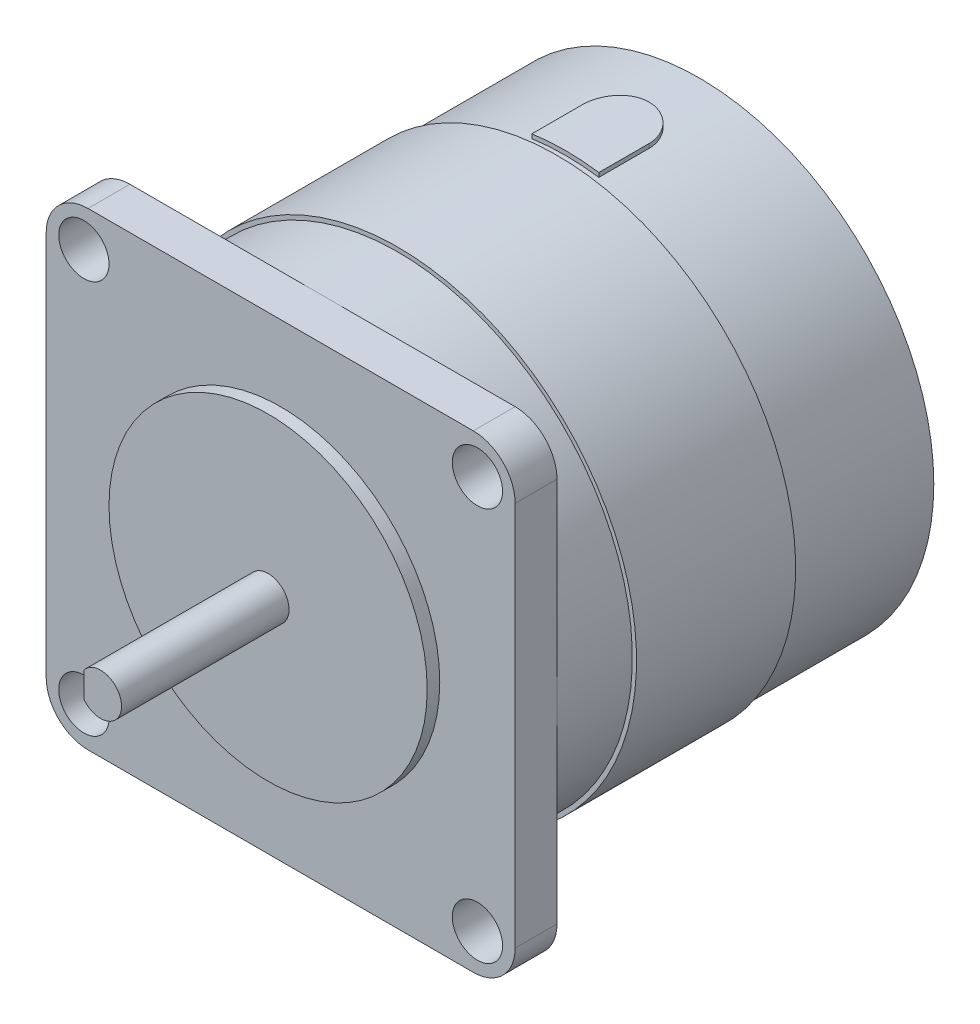
from build123d import *

# Parameters (mm, degrees)
SKETCH1_R           = 28
EXTRUDE1_DEPTH      = 45
SKETCH2_W           = 56
SKETCH2_H           = 56
EXTRUDE2_DEPTH      = 5
SKETCH4_R           = 3
EXTRUDE3_DEPTH      = 5
SKETCH5_W           = 0.5
SKETCH5_H           = 19
SKETCH7_R           = 19
EXTRUDE4_DEPTH      = 1.5
SKETCH9_R           = 2.5
EXTRUDE5_DEPTH      = 20
SKETCH10_W          = 5
SKETCH10_H          = 3
EXTRUDE6_DEPTH      = 10
FILLET1_R           = 5
EXTRUDE7_REACH      = 84.078
EXTRUDE7_END_RADIUS = 28.5


with BuildPart() as part:
    # Sketch1 → Extrude1 (new body)
    with BuildSketch(Plane.XY):
        Circle(SKETCH1_R)
    extrude(amount=EXTRUDE1_DEPTH)

    # Sketch2 → Extrude2 (add)
    with BuildSketch(Plane.XY.offset(45)):
        Rectangle(SKETCH2_W, SKETCH2_H)
    extrude(amount=EXTRUDE2_DEPTH)

    # Sketch4 → Extrude3 (cut)
    with BuildSketch(Plane.XY.offset(50)):
        with Locations((-23.5, 23.5)):
            Circle(SKETCH4_R)
        with Locations((23.5, 23.5)):
            Circle(SKETCH4_R)
        with Locations((-23.5, -23.5)):
            Circle(SKETCH4_R)
        with Locations((23.5, -23.5)):
            Circle(SKETCH4_R)
    extrude(amount=-EXTRUDE3_DEPTH, mode=Mode.SUBTRACT)

    # Sketch5 → Revolve2 (revolve)
    with BuildSketch(Plane(origin=(0, 0, 0), x_dir=(1, 0, 0), z_dir=(0, 1, 0)), mode=Mode.PRIVATE) as revolve2_sk:
        with Locations((28.25, -26.5)):
            Rectangle(SKETCH5_W, SKETCH5_H)
    revolve(revolve2_sk.sketch.rotate(Axis((0, 0, 0), (0, 0, 1)), 180), axis=Axis((0, 0, 0), (0, 0, 1)))

    # Sketch7 → Extrude4 (add)
    with BuildSketch(Plane.XY.offset(50)):
        Circle(SKETCH7_R)
    extrude(amount=EXTRUDE4_DEPTH)

    # Sketch9 → Extrude5 (add)
    with BuildSketch(Plane.XY.offset(51.5)):
        Circle(SKETCH9_R)
    extrude(amount=EXTRUDE5_DEPTH)

    # Sketch10 → Extrude6 (cut)
    with BuildSketch(Plane.XY.offset(71.5)):
        with Locations((-4.5, 0)):
            Rectangle(SKETCH10_W, SKETCH10_H)
    extrude(amount=-EXTRUDE6_DEPTH, mode=Mode.SUBTRACT)

    # Fillet1
    fillet1_edges = [part.edges().sort_by_distance(p)[0] for p in [
        (28, -28, 47.5),
        (28, 28, 47.5),
        (-28, 28, 47.5),
        (-28, -28, 47.5),
    ]]
    fillet(fillet1_edges, radius=FILLET1_R)

    # Extrude7: up to this cylinder (the profile starts inside it)
    extrude7_end = Plane(origin=(0, 0, 11.385608), z_dir=(0, 0, -1)) * Cylinder(EXTRUDE7_END_RADIUS, 226.156, mode=Mode.PRIVATE)
    # Sketch11 → Extrude7 (add, up to the surface)
    with BuildSketch(Plane(origin=(0, 0, 0), x_dir=(1, 0, 0), z_dir=(0, 1, 0)), mode=Mode.PRIVATE) as extrude7_sk1:
        with BuildLine():
            Line((-4, -16), (4, -16))
            Line((4, -16), (4, -10))
            ThreePointArc((4, -10), (0, -6), (-4, -10))
            Line((-4, -10), (-4, -16))
        make_face()
    extrude7_tool1 = extrude(extrude7_sk1.sketch, amount=EXTRUDE7_REACH, mode=Mode.PRIVATE) & extrude7_end
    add(extrude7_tool1.solids().sort_by_distance((0, 0, 11.385608))[0])


solid = part.part
